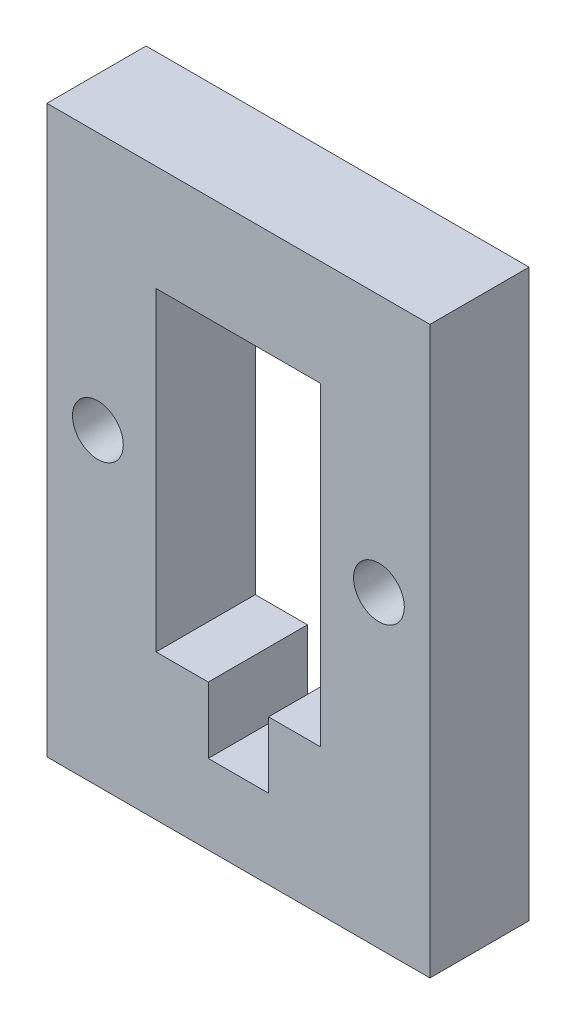
from build123d import *

# Parameters (mm, degrees)
SKETCH1_W           = 28.96
SKETCH1_H           = 11
BOSS_EXTRUDE1_DEPTH = 7.5
SKETCH2_W           = 8.255
SKETCH2_H           = 7.5
BOSS_EXTRUDE2_DEPTH = 23.8
SKETCH3_W           = 28.96
SKETCH3_H           = 7.5
BOSS_EXTRUDE3_DEPTH = 8
SKETCH4_W           = 4.56
SKETCH4_H           = 7.5
CUT_EXTRUDE1_DEPTH  = 5
SKETCH5_R           = 1.92
CUT_EXTRUDE2_DEPTH  = 10


with BuildPart() as part:
    # Sketch1 → Boss-Extrude1 (new body)
    with BuildSketch(Plane.XY):
        with Locations((-4.078230088, 25.589734513)):
            Rectangle(SKETCH1_W, SKETCH1_H)
    extrude(amount=BOSS_EXTRUDE1_DEPTH)

    # Sketch2 → Boss-Extrude2 (add)
    with BuildSketch(Plane(origin=(0, 31.089734513, 0), x_dir=(1, 0, 0), z_dir=(0, 1, 0))):
        with Locations((-14.430730088, -3.75)):
            Rectangle(SKETCH2_W, SKETCH2_H)
        with Locations((6.274269912, -3.75)):
            Rectangle(SKETCH2_W, SKETCH2_H)
    extrude(amount=BOSS_EXTRUDE2_DEPTH)

    # Sketch3 → Boss-Extrude3 (add)
    with BuildSketch(Plane(origin=(0, 54.889734513, 0), x_dir=(1, 0, 0), z_dir=(0, 1, 0))):
        with Locations((-4.078230088, -3.75)):
            Rectangle(SKETCH3_W, SKETCH3_H)
    extrude(amount=BOSS_EXTRUDE3_DEPTH)

    # Sketch4 → Cut-Extrude1 (cut)
    with BuildSketch(Plane(origin=(0, 31.089734513, 0), x_dir=(1, 0, 0), z_dir=(0, 1, 0))):
        with Locations((-4.078230088, -3.75)):
            Rectangle(SKETCH4_W, SKETCH4_H)
    extrude(amount=-CUT_EXTRUDE1_DEPTH, mode=Mode.SUBTRACT)

    # Sketch5 → Cut-Extrude2 (cut)
    with BuildSketch(Plane.XY.offset(7.5)):
        with Locations((-14.703230088, 43.409734513)):
            Circle(SKETCH5_R)
        with Locations((6.546769912, 43.409734513)):
            Circle(SKETCH5_R)
    extrude(amount=-CUT_EXTRUDE2_DEPTH, mode=Mode.SUBTRACT)


solid = part.part
